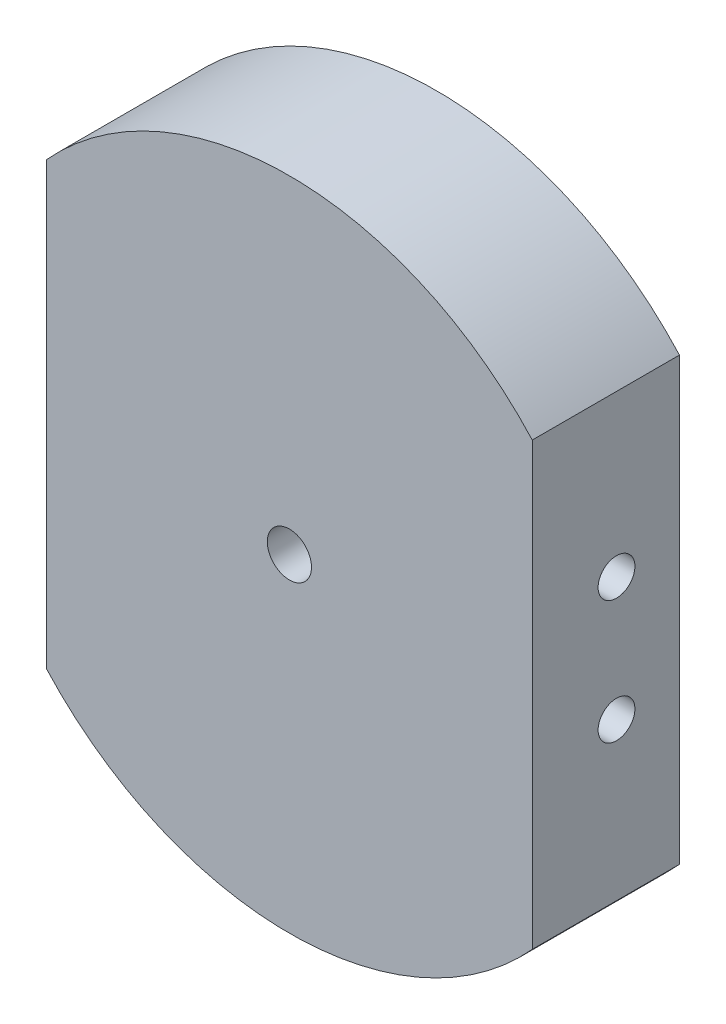
from build123d import *

# Parameters (mm, degrees)
SKETCH1_R           = 55
SKETCH1_R_2         = 3
BOSS_EXTRUDE1_DEPTH = 20
SKETCH2_R           = 52
CUT_EXTRUDE1_DEPTH  = 10
SKETCH3_R           = 73.645142789
CUT_EXTRUDE2_DEPTH  = 40
CUT_EXTRUDE4_START  = -58
CUT_EXTRUDE4_DEPTH  = 58
SKETCH5_R           = 2.5
CUT_EXTRUDE3_DEPTH  = 110


with BuildPart() as part:
    # Sketch1 → Boss-Extrude1 (new body)
    with BuildSketch(Plane.XY):
        Circle(SKETCH1_R)
        Circle(SKETCH1_R_2, mode=Mode.SUBTRACT)
    extrude(amount=BOSS_EXTRUDE1_DEPTH)

    # Sketch2 → Cut-Extrude1 (cut)
    with BuildSketch(Plane.XY.offset(20)):
        Circle(SKETCH2_R)
        with BuildLine():
            Line((-41.361950208, 16.620711788), (-41.361950208, -16.620711788))
            ThreePointArc((-41.361950208, -16.620711788), (0, -44.576439802), (41.361950208, -16.620711788))
            Line((41.361950208, -16.620711788), (41.361950208, 16.620711788))
            ThreePointArc((41.361950208, 16.620711788), (0, 44.576439802), (-41.361950208, 16.620711788))
        make_face(mode=Mode.SUBTRACT)
    extrude(amount=-CUT_EXTRUDE1_DEPTH, mode=Mode.SUBTRACT)

    # Sketch3 → Cut-Extrude2 (cut)
    with BuildSketch(Plane.XY.offset(20)):
        Circle(SKETCH3_R)
        with BuildLine():
            Line((-41.361950208, 16.620711788), (-41.361950208, -16.620711788))
            ThreePointArc((-41.361950208, -16.620711788), (0, -44.576439802), (41.361950208, -16.620711788))
            Line((41.361950208, -16.620711788), (41.361950208, 16.620711788))
            ThreePointArc((41.361950208, 16.620711788), (0, 44.576439802), (-41.361950208, 16.620711788))
        make_face(mode=Mode.SUBTRACT)
    extrude(amount=-CUT_EXTRUDE2_DEPTH, mode=Mode.SUBTRACT)

    # Sketch6 → Cut-Extrude4 (cut)
    with BuildSketch(Plane(origin=(0, 0, 0), x_dir=(-1, 0, 0), z_dir=(0, 0, -1)).offset(CUT_EXTRUDE4_START)):
        with BuildLine():
            ThreePointArc((-41.361950208, 16.620711788), (-37.775123844, 23.66641088), (-33, 29.967632295))
            Line((-33, 29.967632295), (-58.675122088, 18.005162572))
            Line((-58.675122088, 18.005162572), (-58.675122088, -19.387832384))
            Line((-58.675122088, -19.387832384), (-33, -29.967632295))
            ThreePointArc((-33, -29.967632295), (-37.775123844, -23.66641088), (-41.361950208, -16.620711788))
            Line((-41.361950208, -16.620711788), (-41.361950208, 16.620711788))
        make_face()
        with BuildLine():
            Line((-33, -29.967632295), (-33, 29.967632295))
            ThreePointArc((-33, 29.967632295), (-37.775123844, 23.66641088), (-41.361950208, 16.620711788))
            Line((-41.361950208, 16.620711788), (-41.361950208, -16.620711788))
            ThreePointArc((-41.361950208, -16.620711788), (-37.775123844, -23.66641088), (-33, -29.967632295))
        make_face()
        with BuildLine():
            Line((59.4434713, 26.815208095), (33, 29.967632295))
            ThreePointArc((33, 29.967632295), (37.775123844, 23.66641088), (41.361950208, 16.620711788))
            Line((41.361950208, 16.620711788), (41.361950208, -16.620711788))
            ThreePointArc((41.361950208, -16.620711788), (37.775123844, -23.66641088), (33, -29.967632295))
            Line((33, -29.967632295), (59.4434713, -14.291474717))
            Line((59.4434713, -14.291474717), (59.4434713, 26.815208095))
        make_face()
        with BuildLine():
            ThreePointArc((41.361950208, 16.620711788), (37.775123844, 23.66641088), (33, 29.967632295))
            Line((33, 29.967632295), (33, -29.967632295))
            ThreePointArc((33, -29.967632295), (37.775123844, -23.66641088), (41.361950208, -16.620711788))
            Line((41.361950208, -16.620711788), (41.361950208, 16.620711788))
        make_face()
    extrude(amount=CUT_EXTRUDE4_DEPTH, mode=Mode.SUBTRACT)

    # Sketch5 → Cut-Extrude3 (cut)
    with BuildSketch(Plane(origin=(33, 0, 0), x_dir=(0, 0, -1), z_dir=(1, 0, 0))):
        with Locations((-8.553262896, -8.638911455)):
            Circle(SKETCH5_R)
        with Locations((-8.553262896, 8.14)):
            Circle(SKETCH5_R)
    extrude(amount=-CUT_EXTRUDE3_DEPTH, mode=Mode.SUBTRACT)


solid = part.part
